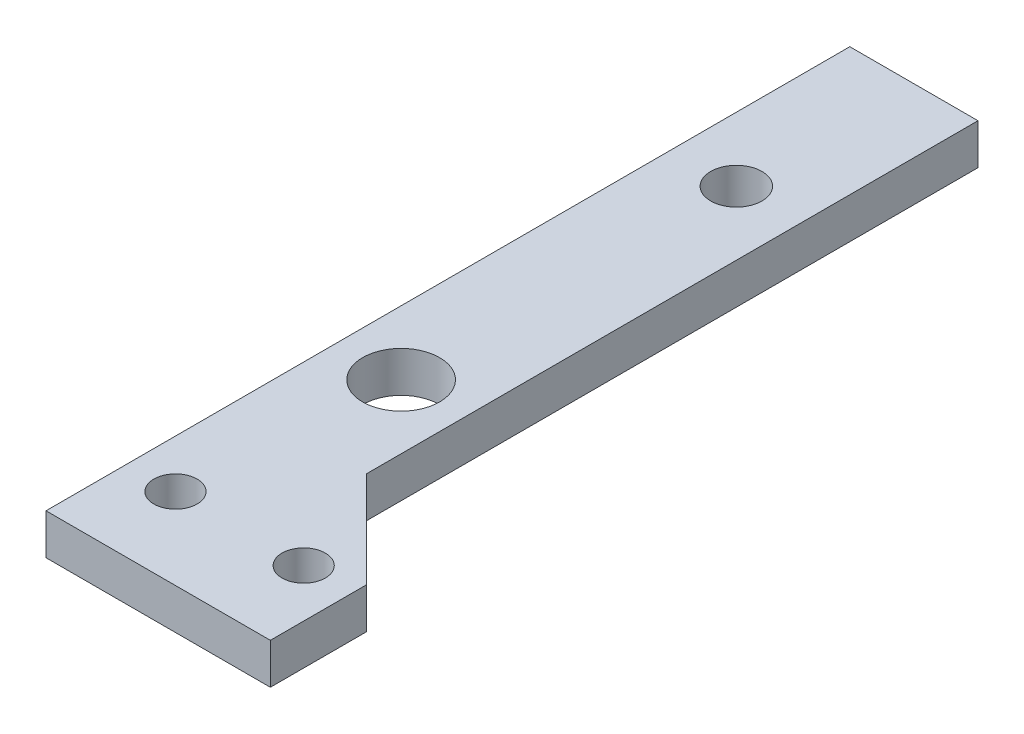
from build123d import *

# Parameters (mm, degrees)
SKETCH2_W               = 20
SKETCH2_H               = 100
SKETCH2_R               = 6
SKETCH2_R_2             = 4
BOSS_EXTRUDE1_DEPTH     = 6.35
SKETCH4_W               = 20
SKETCH4_H               = 25.4
BOSS_EXTRUDE2_DEPTH     = 6.35
BOSS_EXTRUDE3_DEPTH     = 6.35
F_1_4_CLEARANCE_HOLE2_D = 6.7564


with BuildPart() as part:
    # Sketch2 → Boss-Extrude1 (new body)
    with BuildSketch(Plane(origin=(0, 0, 0), x_dir=(1, 0, 0), z_dir=(0, 1, 0))):
        with Locations((10, -50)):
            Rectangle(SKETCH2_W, SKETCH2_H)
        with Locations(Location((10, -80, 0), (0, 0, 270))):
            Circle(SKETCH2_R, mode=Mode.SUBTRACT)
        with Locations(Location((10, -27.7, 0), (0, 0, 270))):
            Circle(SKETCH2_R_2, mode=Mode.SUBTRACT)
    extrude(amount=BOSS_EXTRUDE1_DEPTH)

    # Sketch4 → Boss-Extrude2 (add)
    with BuildSketch(Plane(origin=(0, 6.35, 0), x_dir=(1, 0, 0), z_dir=(0, 1, 0))):
        with Locations((10, -112.7)):
            Rectangle(SKETCH4_W, SKETCH4_H)
    extrude(amount=-BOSS_EXTRUDE2_DEPTH)

    # Sketch8 → Boss-Extrude3 (add)
    with BuildSketch(Plane(origin=(0, 6.35, 0), x_dir=(1, 0, 0), z_dir=(0, 1, 0))):
        Polygon((20, -125.4), (35, -125.4), (35, -110.4), (20, -95.4), align=None)
    extrude(amount=-BOSS_EXTRUDE3_DEPTH)

    # 1/4 Clearance Hole2 (through all)
    with Locations(Plane(origin=(0, 6.35, 0), x_dir=(1, 0, 0), z_dir=(0, 1, 0))):
        with Locations((7.5, -112.7), (27.5, -112.7)):
            Hole(F_1_4_CLEARANCE_HOLE2_D / 2)


solid = part.part
